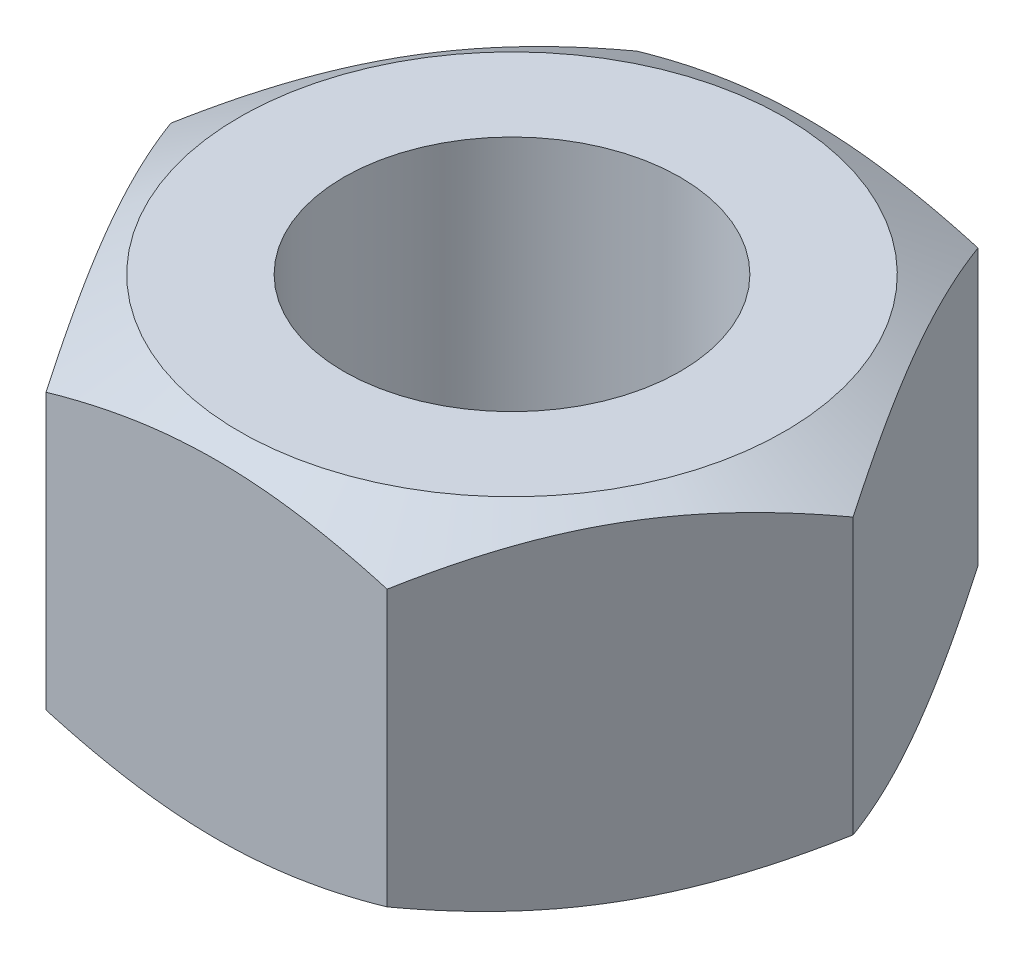
from build123d import *

# Parameters (mm, degrees)
SKETCH1_R      = 5.125
EXTRUDE1_DEPTH = 10.8


with BuildPart() as part:
    # Sketch1 → Extrude1 (new body)
    with BuildSketch(Plane(origin=(0, 0, 0), x_dir=(1, 0, 0), z_dir=(0, 1, 0))):
        Polygon((10.392304845, 0), (5.196152423, 9), (-5.196152423, 9), (-10.392304845, 0), (-5.196152423, -9), (5.196152423, -9), align=None)
        with Locations(Location((0, 0, 0), (0, 0, 90))):
            Circle(SKETCH1_R, mode=Mode.SUBTRACT)
    extrude(amount=EXTRUDE1_DEPTH)

    # Sketch2 → Cut-Revolve1 (revolve, cut)
    with BuildSketch(Plane.XY, mode=Mode.PRIVATE) as cut_revolve1_sk:
        Polygon((-8.3, 10.8), (-10.392304845, 9.592007234), (-10.392304845, 10.8), align=None)
        Polygon((-10.392304845, 1.207992766), (-8.3, 0), (-10.392304845, 0), align=None)
    revolve(cut_revolve1_sk.sketch.rotate(Axis((0, 0, 0), (0, 1, 0)), 270), axis=Axis((0, 0, 0), (0, 1, 0)), mode=Mode.SUBTRACT)


solid = part.part
